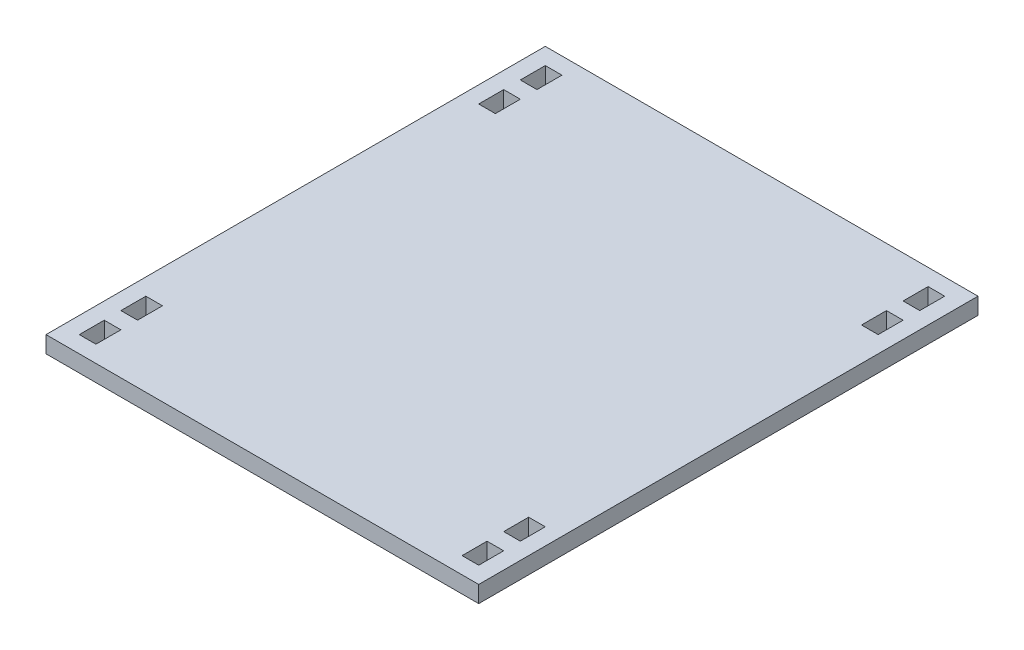
from build123d import *

# Parameters (mm, degrees)
SKETCH1_W            = 82.55
SKETCH1_H            = 95.25
BOSS_EXTRUDE1_DEPTH  = 3.175
SKETCH2_W            = 3.175
SKETCH2_H            = 4.7625
CUT_EXTRUDE1_DEPTH   = 64.101876953
LPATTERN1_COUNT      = 2
LPATTERN1_PITCH      = 76.2
LPATTERN1_COUNT_DIR2 = 2
LPATTERN1_PITCH_DIR2 = 73.025


with BuildPart() as part:
    # Sketch1 → Boss-Extrude1 (new body)
    with BuildSketch(Plane(origin=(0, 0, 0), x_dir=(1, 0, 0), z_dir=(0, 1, 0))):
        Rectangle(SKETCH1_W, SKETCH1_H)
    extrude(amount=BOSS_EXTRUDE1_DEPTH)

    # Sketch2 → Cut-Extrude1 (cut, through all)
    with BuildSketch(Plane(origin=(0, 3.175, 0), x_dir=(1, 0, 0), z_dir=(0, 1, 0))):
        with Locations((-36.5125, 42.06875)):
            Rectangle(SKETCH2_W, SKETCH2_H)
        with Locations((-36.5125, 34.13125)):
            Rectangle(SKETCH2_W, SKETCH2_H)
    cut_extrude1 = extrude(amount=-CUT_EXTRUDE1_DEPTH, mode=Mode.SUBTRACT)

    # LPattern1: Cut-Extrude1 2 × 2
    with Locations(*[(j * LPATTERN1_PITCH_DIR2, 0, i * LPATTERN1_PITCH) for i in range(LPATTERN1_COUNT) for j in range(LPATTERN1_COUNT_DIR2) if (i, j) != (0, 0)]):
        add(cut_extrude1, mode=Mode.SUBTRACT)


solid = part.part
